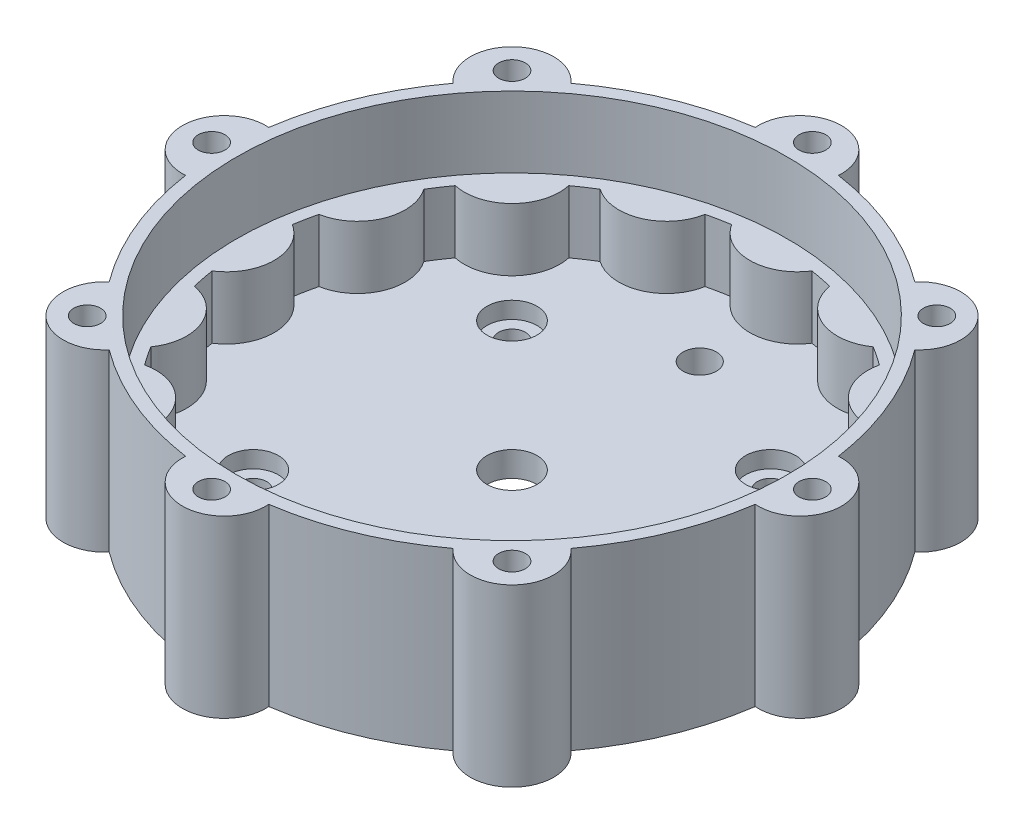
from build123d import *

# Parameters (mm, degrees)
SKETCH1_R           = 34.5
BOSS_EXTRUDE1_DEPTH = 5
BOSS_EXTRUDE2_START = 7.5
SKETCH4_R           = 34.5
SKETCH4_R_2         = 31.5
BOSS_EXTRUDE2_DEPTH = 7.5
SKETCH5_R           = 3
CUT_EXTRUDE1_DEPTH  = 50.363448016
SKETCH6_R           = 3
CUT_EXTRUDE2_DEPTH  = 2
SKETCH8_R           = 1.6
CUT_EXTRUDE3_DEPTH  = 50.363448016
BOSS_EXTRUDE3_START = 7.5
BOSS_EXTRUDE3_DEPTH = 7.5
CIRPATTERN1_COUNT   = 16
SKETCH10_R          = 11.5
CUT_EXTRUDE4_DEPTH  = 2
BOSS_EXTRUDE4_START = 8.5
SKETCH11_R          = 34.5
SKETCH11_R_2        = 33
BOSS_EXTRUDE4_DEPTH = 8.5
BOSS_EXTRUDE5_START = -21
BOSS_EXTRUDE5_DEPTH = 21
SKETCH15_R          = 1.6
CUT_EXTRUDE5_DEPTH  = 15
CIRPATTERN2_COUNT   = 8
SKETCH16_R          = 2
CUT_EXTRUDE6_DEPTH  = 59.107658703


with BuildPart() as part:
    # Sketch1 → Boss-Extrude1 (new body)
    with BuildSketch(Plane(origin=(0, 0, 0), x_dir=(1, 0, 0), z_dir=(0, 1, 0))):
        with Locations(Location((0, 0, 0), (0, 0, 270))):
            Circle(SKETCH1_R)
    extrude(amount=-BOSS_EXTRUDE1_DEPTH)

    # Sketch4 → Boss-Extrude2 (add)
    with BuildSketch(Plane(origin=(0, 0, 0), x_dir=(1, 0, 0), z_dir=(0, 1, 0)).offset(BOSS_EXTRUDE2_START)):
        with Locations(Location((0, 0, 0), (0, 0, 270))):
            Circle(SKETCH4_R)
        with Locations(Location((0, 0, 0), (0, 0, 270))):
            Circle(SKETCH4_R_2, mode=Mode.SUBTRACT)
    extrude(amount=-BOSS_EXTRUDE2_DEPTH)

    # Sketch5 → Cut-Extrude1 (cut, through all)
    with BuildSketch(Plane(origin=(0, 0, 0), x_dir=(1, 0, 0), z_dir=(0, 1, 0))):
        with Locations(Location((0, 0, 0), (0, 0, 270))):
            Circle(SKETCH5_R)
    extrude(amount=-CUT_EXTRUDE1_DEPTH, mode=Mode.SUBTRACT)

    # Sketch6 → Cut-Extrude2 (cut)
    with BuildSketch(Plane(origin=(0, 0, 0), x_dir=(1, 0, 0), z_dir=(0, 1, 0))):
        with Locations(Location((-15.5, 15.5, 0), (0, 0, 270))):
            Circle(SKETCH6_R)
        with Locations(Location((15.5, 15.5, 0), (0, 0, 270))):
            Circle(SKETCH6_R)
        with Locations(Location((15.5, -15.5, 0), (0, 0, 270))):
            Circle(SKETCH6_R)
        with Locations(Location((-15.5, -15.5, 0), (0, 0, 270))):
            Circle(SKETCH6_R)
    extrude(amount=-CUT_EXTRUDE2_DEPTH, mode=Mode.SUBTRACT)

    # Sketch8 → Cut-Extrude3 (cut, through all)
    with BuildSketch(Plane(origin=(0, 0, 0), x_dir=(1, 0, 0), z_dir=(0, 1, 0))):
        with Locations(Location((-15.5, 15.5, 0), (0, 0, 270))):
            Circle(SKETCH8_R)
        with Locations(Location((15.5, 15.5, 0), (0, 0, 270))):
            Circle(SKETCH8_R)
        with Locations(Location((15.5, -15.5, 0), (0, 0, 270))):
            Circle(SKETCH8_R)
        with Locations(Location((-15.5, -15.5, 0), (0, 0, 270))):
            Circle(SKETCH8_R)
    extrude(amount=-CUT_EXTRUDE3_DEPTH, mode=Mode.SUBTRACT)

    # Sketch9 → Boss-Extrude3 (add)
    with BuildSketch(Plane(origin=(0, 0, 0), x_dir=(1, 0, 0), z_dir=(0, 1, 0)).offset(BOSS_EXTRUDE3_START)):
        with BuildLine():
            ThreePointArc((-4.810876836, 31.130458783), (0, 28.5), (4.810876836, 31.130458783))
            ThreePointArc((4.810876836, 31.130458783), (0, 31.5), (-4.810876836, 31.130458783))
        make_face()
    boss_extrude3 = extrude(amount=-BOSS_EXTRUDE3_DEPTH)

    # CirPattern1: Boss-Extrude3 ×16 about axis
    cirpattern1_axis = Axis((0, 0, 0), (0, 1, 0))
    for i in range(1, CIRPATTERN1_COUNT):
        add(boss_extrude3.rotate(cirpattern1_axis, i * 360 / CIRPATTERN1_COUNT))

    # Sketch10 → Cut-Extrude4 (cut)
    with BuildSketch(Plane(origin=(0, -5, 0), x_dir=(-1, 0, 0), z_dir=(0, -1, 0))):
        with Locations(Location((0, 0, 0), (0, 0, 90))):
            Circle(SKETCH10_R)
    extrude(amount=-CUT_EXTRUDE4_DEPTH, mode=Mode.SUBTRACT)

    # Sketch11 → Boss-Extrude4 (add)
    with BuildSketch(Plane(origin=(0, 7.5, 0), x_dir=(1, 0, 0), z_dir=(0, 1, 0)).offset(BOSS_EXTRUDE4_START)):
        with Locations(Location((0, 0, 0), (0, 0, 270))):
            Circle(SKETCH11_R)
        with Locations(Location((0, 0, 0), (0, 0, 270))):
            Circle(SKETCH11_R_2, mode=Mode.SUBTRACT)
    extrude(amount=-BOSS_EXTRUDE4_DEPTH)

    # Sketch12 → Boss-Extrude5 (add)
    with BuildSketch(Plane.XZ.offset(5).offset(BOSS_EXTRUDE5_START)):
        with BuildLine():
            ThreePointArc((-4.986855227, 34.137681159), (0, 34.5), (4.986855227, 34.137681159))
            ThreePointArc((4.986855227, 34.137681159), (0, 39.5), (-4.986855227, 34.137681159))
        make_face()
    boss_extrude5 = extrude(amount=BOSS_EXTRUDE5_DEPTH)

    # Sketch15 → Cut-Extrude5 (cut)
    with BuildSketch(Plane(origin=(0, 16, 0), x_dir=(1, 0, 0), z_dir=(0, 1, 0))):
        with Locations(Location((0, -36, 0), (0, 0, 270))):
            Circle(SKETCH15_R)
    cut_extrude5 = extrude(amount=-CUT_EXTRUDE5_DEPTH, mode=Mode.SUBTRACT)

    # CirPattern2: Boss-Extrude5, Cut-Extrude5 ×8 about axis
    cirpattern2_axis = Axis((0, 0, 0), (0, 1, 0))
    add([boss_extrude5.rotate(cirpattern2_axis, i * 360 / CIRPATTERN2_COUNT) for i in range(1, CIRPATTERN2_COUNT)])
    add([cut_extrude5.rotate(cirpattern2_axis, i * 360 / CIRPATTERN2_COUNT) for i in range(1, CIRPATTERN2_COUNT)], mode=Mode.SUBTRACT)

    # Sketch16 → Cut-Extrude6 (cut, through all)
    with BuildSketch(Plane(origin=(0, 0, 0), x_dir=(1, 0, 0), z_dir=(0, 1, 0))):
        with Locations(Location((0, 22.5, 0), (0, 0, 270))):
            Circle(SKETCH16_R)
    extrude(amount=-CUT_EXTRUDE6_DEPTH, mode=Mode.SUBTRACT)


solid = part.part
